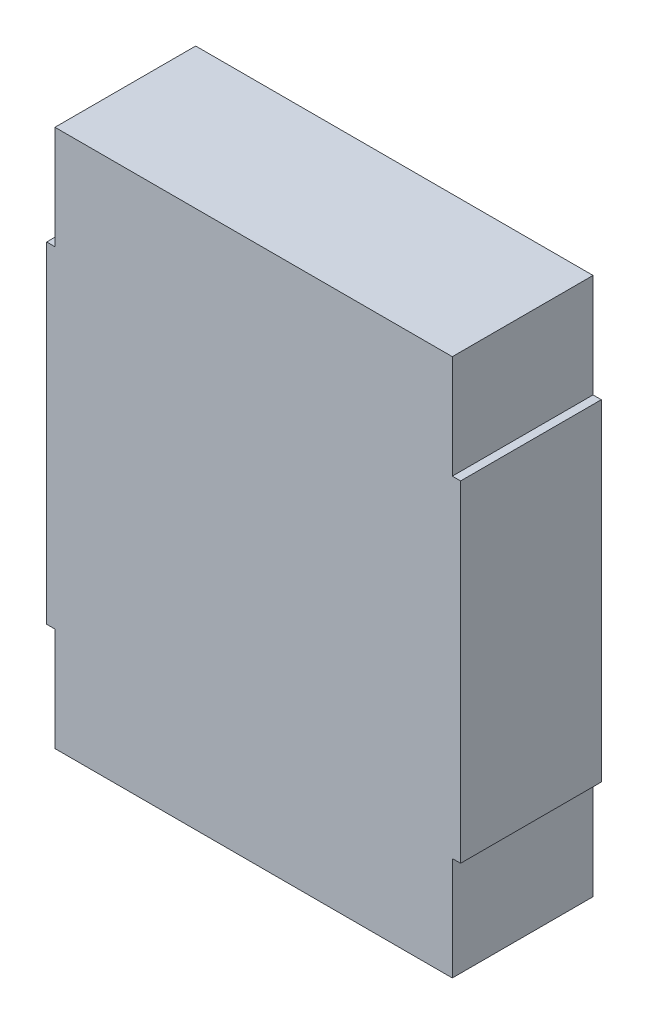
from build123d import *

# Parameters (mm, degrees)
COMPONENT_OUTLINE_DEPTH = 1.7


with BuildPart() as part:
    # 草图1 → Component_Outline (new body)
    with BuildSketch(Plane.XY):
        Polygon((-2.4, -3.25), (-2.4, -2), (-2.5, -2), (-2.5, 2), (-2.4, 2), (-2.4, 3.25), (2.4, 3.25), (2.4, 2), (2.5, 2), (2.5, -2), (2.4, -2), (2.4, -3.25), align=None)
    extrude(amount=COMPONENT_OUTLINE_DEPTH)


solid = part.part
